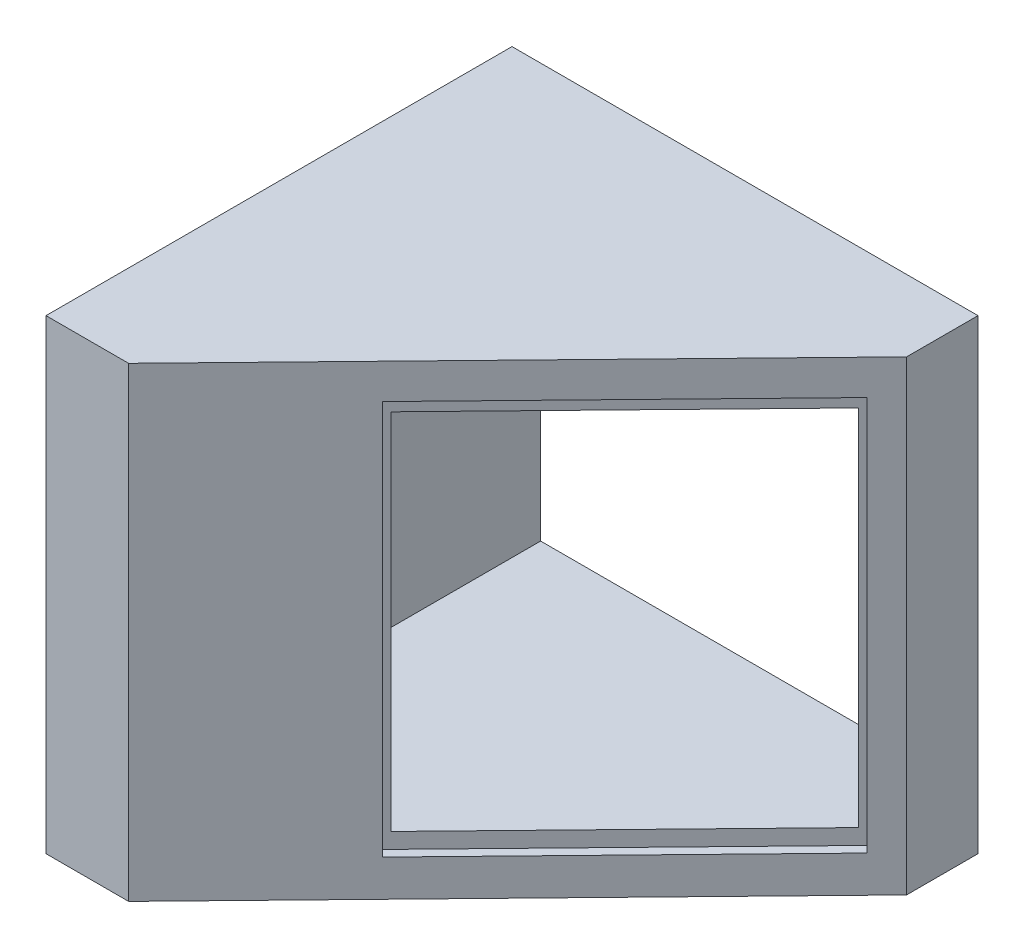
from build123d import *

# Parameters (mm, degrees)
SKETCH3_W           = 150
SKETCH3_H           = 150
BOSS_EXTRUDE2_DEPTH = 150
CUT_EXTRUDE3_DEPTH  = 150
SKETCH8_W           = 131.044313332
SKETCH8_H           = 116.977993985
CUT_EXTRUDE7_DEPTH  = 105
SKETCH9_W           = 4.954866237
SKETCH9_H           = 116.977993985
CUT_EXTRUDE10_DEPTH = 3
SKETCH10_W          = 105.341543671
SKETCH10_H          = 5
CUT_EXTRUDE12_DEPTH = 3
SKETCH11_W          = 5
SKETCH11_H          = 121.977993985
CUT_EXTRUDE13_DEPTH = 3
SKETCH12_W          = 110.341543671
SKETCH12_H          = 5
CUT_EXTRUDE14_DEPTH = 3


with BuildPart() as part:
    # Sketch3 → Boss-Extrude2 (new body)
    with BuildSketch(Plane.XY):
        with Locations((-13.712644514, -4.259252527)):
            Rectangle(SKETCH3_W, SKETCH3_H)
    extrude(amount=BOSS_EXTRUDE2_DEPTH)

    # Sketch6 → Cut-Extrude3 (cut)
    with BuildSketch(Plane.XZ.offset(79.259252527)):
        Polygon((61.287355486, 22.975304178), (-62.11733168, 150), (61.287355486, 150), align=None)
    extrude(amount=-CUT_EXTRUDE3_DEPTH, mode=Mode.SUBTRACT)

    # Sketch8 → Cut-Extrude7 (cut)
    with BuildSketch(Plane(origin=(0, 0, 0), x_dir=(-1, 0, 0), z_dir=(0, 0, -1))):
        with Locations((13.971216561, -4.00068048)):
            Rectangle(SKETCH8_W, SKETCH8_H)
    extrude(amount=-CUT_EXTRUDE7_DEPTH, mode=Mode.SUBTRACT)

    # Sketch9 → Cut-Extrude10 (cut)
    with BuildSketch(Plane(origin=(43.01226643, 0, 41.786482925), x_dir=(0.696812609304925, 0, -0.71725322412218), z_dir=(0.71725322412218, 0, 0.696812609304925))):
        with Locations((-90.610208196, -4.00068048)):
            Rectangle(SKETCH9_W, SKETCH9_H)
    extrude(amount=-CUT_EXTRUDE10_DEPTH, mode=Mode.SUBTRACT)

    # Sketch10 → Cut-Extrude12 (cut)
    with BuildSketch(Plane(origin=(43.01226643, 0, 41.786482925), x_dir=(0.696812609304925, 0, -0.71725322412218), z_dir=(0.71725322412218, 0, 0.696812609304925))):
        with Locations((-40.416869479, -64.989677472)):
            Rectangle(SKETCH10_W, SKETCH10_H)
    extrude(amount=-CUT_EXTRUDE12_DEPTH, mode=Mode.SUBTRACT)

    # Sketch11 → Cut-Extrude13 (cut)
    with BuildSketch(Plane(origin=(43.01226643, 0, 41.786482925), x_dir=(0.696812609304925, 0, -0.71725322412218), z_dir=(0.71725322412218, 0, 0.696812609304925))):
        with Locations((14.753902357, -6.50068048)):
            Rectangle(SKETCH11_W, SKETCH11_H)
    extrude(amount=-CUT_EXTRUDE13_DEPTH, mode=Mode.SUBTRACT)

    # Sketch12 → Cut-Extrude14 (cut)
    with BuildSketch(Plane(origin=(43.01226643, 0, 41.786482925), x_dir=(0.696812609304925, 0, -0.71725322412218), z_dir=(0.71725322412218, 0, 0.696812609304925))):
        with Locations((-37.916869479, 56.988316513)):
            Rectangle(SKETCH12_W, SKETCH12_H)
    extrude(amount=-CUT_EXTRUDE14_DEPTH, mode=Mode.SUBTRACT)


solid = part.part
